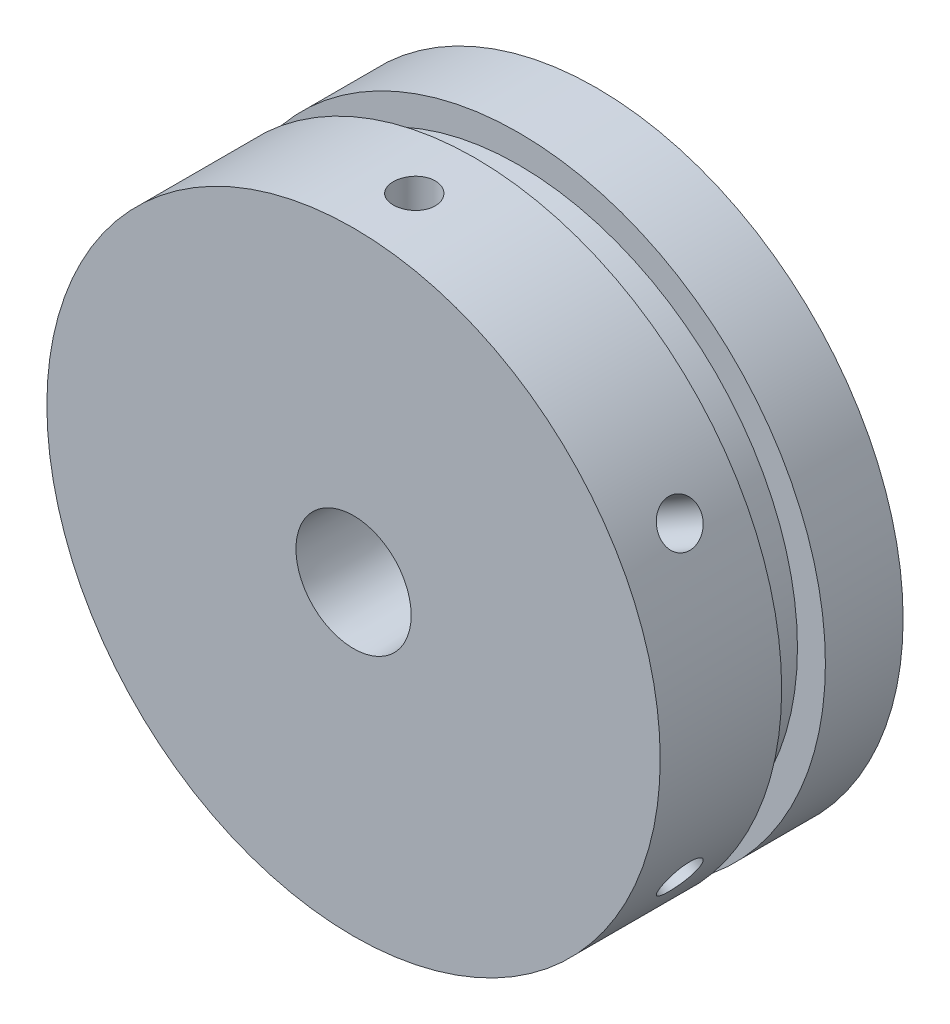
from build123d import *

# Parameters (mm, degrees)
SKETCH2_R           = 25.25
BOSS_EXTRUDE1_DEPTH = 20
SKETCH3_W           = 3.6
SKETCH3_H           = 2.3
CIRPATTERN1_COUNT   = 6


with BuildPart() as part:
    # Sketch2 → Boss-Extrude1 (new body)
    with BuildSketch(Plane.XY):
        Circle(SKETCH2_R)
    extrude(amount=BOSS_EXTRUDE1_DEPTH)

    # Sketch3 → Cut-Revolve1 (revolve, cut)
    with BuildSketch(Plane(origin=(0, 0, 0), x_dir=(0, 0, -1), z_dir=(1, 0, 0)), mode=Mode.PRIVATE) as cut_revolve1_sk:
        with Locations((-8.2, 24.1)):
            Rectangle(SKETCH3_W, SKETCH3_H)
    revolve(cut_revolve1_sk.sketch.rotate(Axis((0, 0, 0), (0, 0, 1)), 90), axis=Axis((0, 0, 0), (0, 0, 1)), mode=Mode.SUBTRACT)

    # Sketch7 → #8-32 Tapped Hole2 (revolve, cut)
    with BuildSketch(Plane(origin=(0, 25.25, 15), x_dir=(0, 0, 1), z_dir=(1, 0, 0))):
        Polygon((0, 0), (0, 11.037806461), (1.7272, 10), (1.7272, 0), align=None)
    f_8_32_tapped_hole2 = revolve(axis=Axis((0, 31.6, 15), (0, -1, 0)), mode=Mode.SUBTRACT)

    # CirPattern1: #8-32 Tapped Hole2 ×6 about axis
    cirpattern1_axis = Axis((0, 0, 21.768762267), (0, 0, -1))
    for i in range(1, CIRPATTERN1_COUNT):
        add(f_8_32_tapped_hole2.rotate(cirpattern1_axis, i * 360 / CIRPATTERN1_COUNT), mode=Mode.SUBTRACT)

    # Sketch11 → 1/8 NPT Tapped Hole1 (revolve, cut)
    with BuildSketch(Plane(origin=(0, 0, 20), x_dir=(0, -1, 0), z_dir=(1, 0, 0))):
        Polygon((0, 0), (0, 17.533468714), (4.2164, 15), (4.2164, 6.92), (4.528555848, 6.92), (4.744593, 0), align=None)
    revolve(axis=Axis((0, 0, 26.35), (0, 0, -1)), mode=Mode.SUBTRACT)


solid = part.part
